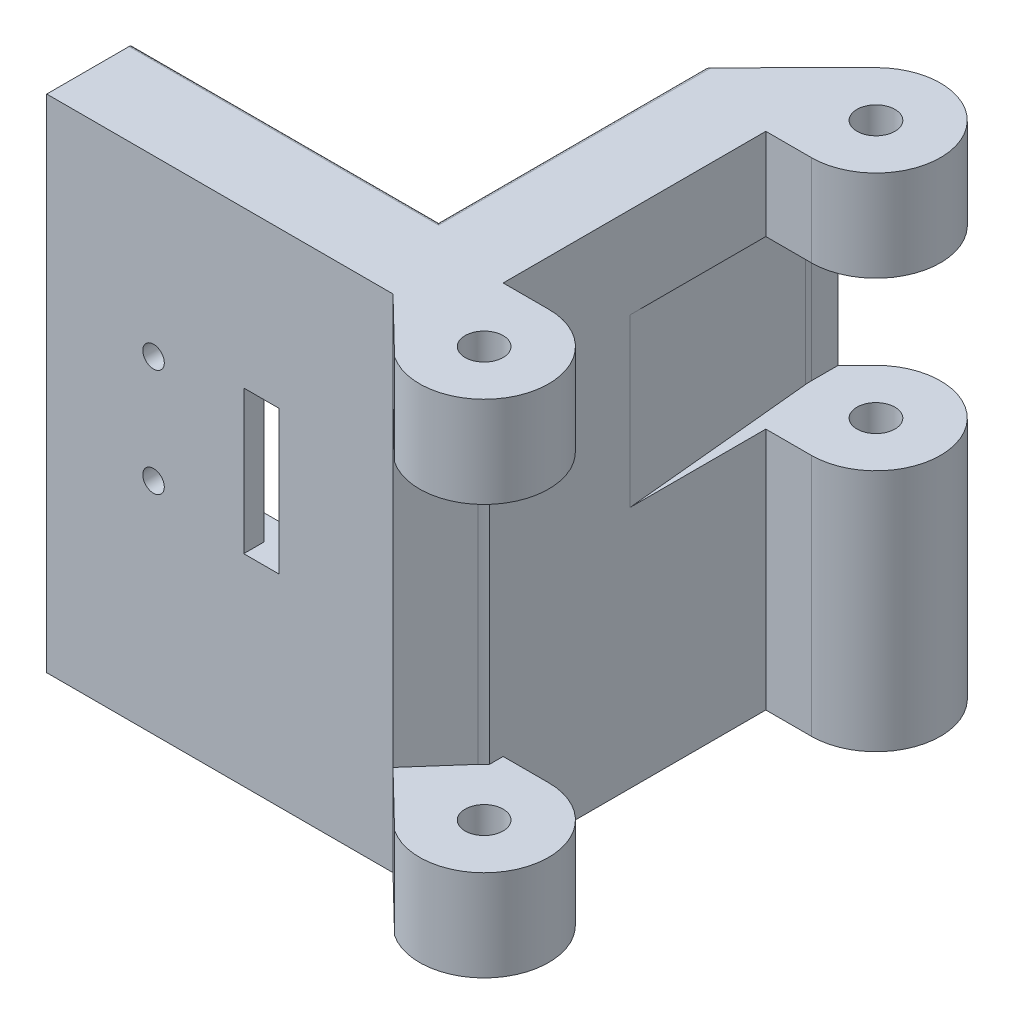
from build123d import *

# Parameters (mm, degrees)
SKETCH1_R               = 2.65
BOSS_EXTRUDE1_DEPTH     = 69.85
BOSS_EXTRUDE2_REACH     = 119.557
BOSS_EXTRUDE3_REACH     = 116.246
CUT_EXTRUDE3_START      = -35.94
SKETCH7_R               = 2.65
CUT_EXTRUDE3_DEPTH      = 23.24
CUT_EXTRUDE2_START      = -12.7
SKETCH6_R               = 2.65
CUT_EXTRUDE2_DEPTH      = 44.45
FILLET1_R               = 0.508
SKETCH8_W               = 20
SKETCH8_H               = 20
CUT_EXTRUDE4_DEPTH      = 3.5
CUT_EXTRUDE6_DEPTH      = 117.039655722
CUT_EXTRUDE6_DEPTH_BACK = 117.039655722
SKETCH10_R              = 1.5
SKETCH10_W              = 4.926728391
SKETCH10_H              = 20


with BuildPart() as part:
    # Sketch1 → Boss-Extrude1 (new body)
    with BuildSketch(Plane(origin=(0, 0, 0), x_dir=(1, 0, 0), z_dir=(0, 1, 0))):
        with BuildLine():
            ThreePointArc((55.958719807, -7.48245925), (69.572262573, -2.613222795), (60.96, 9))
            Line((60.96, 9), (54.61, 9))
            Line((54.61, 9), (54.61, 45.61))
            Line((54.61, 45.61), (60.96, 45.61))
            ThreePointArc((60.96, 45.61), (69.27112045, 58.063299416), (54.582047244, 60.959938476))
            Line((54.582047244, 60.959938476), (48.26, 54.61))
            Line((48.26, 54.61), (48.26, 6.35))
            Line((48.26, 6.35), (0, 6.35))
            Line((0, 6.35), (0, 0))
            Line((0, 0), (48.26, 0))
            Line((48.26, 0), (55.958719807, -7.48245925))
        make_face()
        with Locations(Location((60.96, 0, 0), (0, 0, 270))):
            Circle(SKETCH1_R, mode=Mode.SUBTRACT)
        with Locations(Location((60.96, 54.61, 0), (0, 0, 270))):
            Circle(SKETCH1_R, mode=Mode.SUBTRACT)
    extrude(amount=BOSS_EXTRUDE1_DEPTH)

    # Sketch3 → Boss-Extrude2 (add, up to next)
    with BuildSketch(Plane.ZY, mode=Mode.PRIVATE) as boss_extrude2_sk1:
        Polygon((-6.35, 69.85), (-6.35, 63.5), (-12.7, 69.85), align=None)
    boss_extrude2_tool1 = extrude(boss_extrude2_sk1.sketch, amount=-BOSS_EXTRUDE2_REACH, mode=Mode.PRIVATE) - part.part
    # Sketch3 → Boss-Extrude2 (add, up to next)
    with BuildSketch(Plane.ZY, mode=Mode.PRIVATE) as boss_extrude2_sk2:
        Polygon((-6.35, 0), (-6.35, 6.35), (-12.7, 0), align=None)
    boss_extrude2_tool2 = extrude(boss_extrude2_sk2.sketch, amount=-BOSS_EXTRUDE2_REACH, mode=Mode.PRIVATE) - part.part
    add(boss_extrude2_tool1.solids().sort_by_distance((0, 67.733333, -8.466667))[0])
    add(boss_extrude2_tool2.solids().sort_by_distance((0, 2.116667, -8.466667))[0])

    # Boss-Extrude3: up to this plane
    boss_extrude3_end = Plane(origin=(-3.068514972, 69.85, -3.055036942), z_dir=(-0.7086614173228347, 0, -0.7055487195070168))
    # Sketch4 → Boss-Extrude3 (add, up to the surface)
    with BuildSketch(Plane(origin=(0, 0, -6.35), x_dir=(-1, 0, 0), z_dir=(0, 0, -1)), mode=Mode.PRIVATE) as boss_extrude3_sk1:
        Polygon((-48.26, 69.85), (-48.26, 63.5), (-41.91, 69.85), align=None)
    boss_extrude3_tool1 = split(extrude(boss_extrude3_sk1.sketch, amount=BOSS_EXTRUDE3_REACH, mode=Mode.PRIVATE), bisect_by=boss_extrude3_end, keep=Keep.BOTH, mode=Mode.PRIVATE)
    add(boss_extrude3_tool1.solids().sort_by_distance((46.143333, 67.733333, -6.35))[0])
    # Sketch4 → Boss-Extrude3 (add, up to the surface)
    with BuildSketch(Plane(origin=(0, 0, -6.35), x_dir=(-1, 0, 0), z_dir=(0, 0, -1)), mode=Mode.PRIVATE) as boss_extrude3_sk2:
        Polygon((-48.26, 6.35), (-48.26, 0), (-41.91, 0), align=None)
    boss_extrude3_tool2 = split(extrude(boss_extrude3_sk2.sketch, amount=BOSS_EXTRUDE3_REACH, mode=Mode.PRIVATE), bisect_by=boss_extrude3_end, keep=Keep.BOTH, mode=Mode.PRIVATE)
    add(boss_extrude3_tool2.solids().sort_by_distance((46.143333, 2.116667, -6.35))[0])

    # Sketch7 → Cut-Extrude3 (cut)
    # profile 1 of 4: a face of its own
    with BuildSketch(Plane(origin=(0, 69.85, 0), x_dir=(1, 0, 0), z_dir=(0, 1, 0)).offset(CUT_EXTRUDE3_START)):
        with BuildLine():
            ThreePointArc((52.001434215, 53.747388227), (52.824115031, 50.761964686), (54.61, 48.232108499))
            ThreePointArc((54.61, 48.232108499), (57.524961682, 46.291315503), (60.96, 45.61))
            ThreePointArc((60.96, 45.61), (67.323961031, 48.246038969), (69.96, 54.61))
            ThreePointArc((69.96, 54.61), (64.394998195, 62.928701065), (54.582047244, 60.959938476))
            ThreePointArc((54.582047244, 60.959938476), (52.641298935, 58.044998195), (51.96, 54.61))
            ThreePointArc((51.96, 54.61), (51.970364522, 54.178196843), (52.001434215, 53.747388227))
        make_face()
        with Locations(Location((60.96, 54.61, 0), (0, 0, 270))):
            Circle(SKETCH7_R, mode=Mode.SUBTRACT)
    # profile 2 of 4: a face of its own
    with BuildSketch(Plane(origin=(0, 69.85, 0), x_dir=(1, 0, 0), z_dir=(0, 1, 0)).offset(CUT_EXTRUDE3_START)):
        with BuildLine():
            Line((54.61, 48.232108499), (54.61, 45.61))
            Line((54.61, 45.61), (60.96, 45.61))
            ThreePointArc((60.96, 45.61), (57.524961682, 46.291315503), (54.61, 48.232108499))
        make_face()
    # profile 3 of 4: a face of its own
    with BuildSketch(Plane(origin=(0, 69.85, 0), x_dir=(1, 0, 0), z_dir=(0, 1, 0)).offset(CUT_EXTRUDE3_START)):
        with BuildLine():
            Line((51.96, 58.32632344), (51.96, 54.61))
            ThreePointArc((51.96, 54.61), (52.641298935, 58.044998195), (54.582047244, 60.959938476))
            Line((54.582047244, 60.959938476), (51.96, 58.32632344))
        make_face()
    # profile 4 of 4: a face of its own
    with BuildSketch(Plane(origin=(0, 69.85, 0), x_dir=(1, 0, 0), z_dir=(0, 1, 0)).offset(CUT_EXTRUDE3_START)):
        with BuildLine():
            Line((54.61, 26.656396737), (54.61, 45.61))
            Line((54.61, 45.61), (54.61, 48.232108499))
            ThreePointArc((54.61, 48.232108499), (52.824115031, 50.761964686), (52.001434215, 53.747388227))
            Line((52.001434215, 53.747388227), (54.61, 26.656396737))
        make_face()
    extrude(amount=CUT_EXTRUDE3_DEPTH, mode=Mode.SUBTRACT)

    # Sketch6 → Cut-Extrude2 (cut)
    # profile 1 of 7: a face of its own
    with BuildSketch(Plane(origin=(0, 0, 0), x_dir=(-1, 0, 0), z_dir=(0, -1, 0)).offset(CUT_EXTRUDE2_START)):
        with BuildLine():
            Line((-60.96, 9), (-57.841406567, 9))
            ThreePointArc((-57.841406567, 9), (-69.785888373, -3.581803934), (-52.451441296, -4.281361207))
            ThreePointArc((-52.451441296, -4.281361207), (-52.357529126, -4.089391135), (-52.267947508, -3.895362431))
            Line((-52.267947508, -3.895362431), (-55.958719807, -7.48245925))
            ThreePointArc((-55.958719807, -7.48245925), (-69.572262573, -2.613222795), (-60.96, 9))
        make_face()
    # profile 2 of 7: a face of its own
    with BuildSketch(Plane(origin=(0, 0, 0), x_dir=(-1, 0, 0), z_dir=(0, -1, 0)).offset(CUT_EXTRUDE2_START)):
        with BuildLine():
            ThreePointArc((-53.816250004, 6.300195314), (-54.20129816, 6.711599991), (-54.61, 7.099515829))
            ThreePointArc((-54.61, 7.099515829), (-56.131281182, 8.210304475), (-57.841406567, 9))
            Line((-57.841406567, 9), (-60.96, 9))
            ThreePointArc((-60.96, 9), (-69.572262573, -2.613222795), (-55.958719807, -7.48245925))
            Line((-55.958719807, -7.48245925), (-52.267947508, -3.895362431))
            ThreePointArc((-52.267947508, -3.895362431), (-51.645564295, -1.991710949), (-51.435, 0))
            ThreePointArc((-51.435, 0), (-52.050178349, 3.367596048), (-53.816250004, 6.300195314))
        make_face()
        with Locations(Location((-60.96, 0, 0), (0, 0, 270))):
            Circle(SKETCH6_R, mode=Mode.SUBTRACT)
    # profile 3 of 7: a face of its own
    with BuildSketch(Plane(origin=(0, 0, 0), x_dir=(-1, 0, 0), z_dir=(0, -1, 0)).offset(CUT_EXTRUDE2_START)):
        with Locations(Location((-60.96, 0, 0), (0, 0, 270))):
            Circle(SKETCH6_R)
    # profile 4 of 7: a face of its own
    with BuildSketch(Plane(origin=(0, 0, 0), x_dir=(-1, 0, 0), z_dir=(0, -1, 0)).offset(CUT_EXTRUDE2_START)):
        with BuildLine():
            Line((-52.267947508, -3.895362431), (-48.26, 0))
            Line((-48.26, 0), (-51.435, 0))
            ThreePointArc((-51.435, 0), (-51.645564295, -1.991710949), (-52.267947508, -3.895362431))
        make_face()
    # profile 5 of 7: a face of its own
    with BuildSketch(Plane(origin=(0, 0, 0), x_dir=(-1, 0, 0), z_dir=(0, -1, 0)).offset(CUT_EXTRUDE2_START)):
        with BuildLine():
            ThreePointArc((-52.267947508, -3.895362431), (-52.357529126, -4.089391135), (-52.451441296, -4.281361207))
            Line((-52.451441296, -4.281361207), (-48.26, 0))
            Line((-48.26, 0), (-52.267947508, -3.895362431))
        make_face()
    # profile 6 of 7: a face of its own
    with BuildSketch(Plane(origin=(0, 0, 0), x_dir=(-1, 0, 0), z_dir=(0, -1, 0)).offset(CUT_EXTRUDE2_START)):
        with BuildLine():
            Line((-54.61, 7.099515829), (-54.61, 9))
            Line((-54.61, 9), (-57.841406567, 9))
            ThreePointArc((-57.841406567, 9), (-56.131281182, 8.210304475), (-54.61, 7.099515829))
        make_face()
    # profile 7 of 7: a face of its own
    with BuildSketch(Plane(origin=(0, 0, 0), x_dir=(-1, 0, 0), z_dir=(0, -1, 0)).offset(CUT_EXTRUDE2_START)):
        with BuildLine():
            Line((-48.26, 0), (-53.816250004, 6.300195314))
            ThreePointArc((-53.816250004, 6.300195314), (-52.050178349, 3.367596048), (-51.435, 0))
            Line((-51.435, 0), (-48.26, 0))
        make_face()
    extrude(amount=-CUT_EXTRUDE2_DEPTH, mode=Mode.SUBTRACT)

    # Fillet1
    fillet1_edges = [part.edges().sort_by_distance(p)[0] for p in [
        (20.955, 69.85, -12.7),
        (41.91, 69.85, -30.465992724),
        (20.955, 0, -12.7),
        (41.91, 0, -30.465992724),
    ]]
    fillet(fillet1_edges, radius=FILLET1_R)

    # Sketch8 → Cut-Extrude4 (cut)
    with BuildSketch(Plane(origin=(0, 0, -6.35), x_dir=(-1, 0, 0), z_dir=(0, 0, -1))):
        with Locations((-22.385, 38.1)):
            Rectangle(SKETCH8_W, SKETCH8_H)
    extrude(amount=-CUT_EXTRUDE4_DEPTH, mode=Mode.SUBTRACT)

    # Sketch10 → Cut-Extrude6 (cut, two sides: drawn at the far end of the back side and taken through both)
    with BuildSketch(Plane(origin=(0, 0, -2.85), x_dir=(-1, 0, 0), z_dir=(0, 0, -1)).offset(-CUT_EXTRUDE6_DEPTH_BACK)):
        with Locations((-14.885, 30.6)):
            Circle(SKETCH10_R)
        with Locations((-14.885, 45.6)):
            Circle(SKETCH10_R)
        with Locations((-29.921635805, 38.1)):
            Rectangle(SKETCH10_W, SKETCH10_H)
    extrude(amount=CUT_EXTRUDE6_DEPTH + CUT_EXTRUDE6_DEPTH_BACK, mode=Mode.SUBTRACT)


solid = part.part
